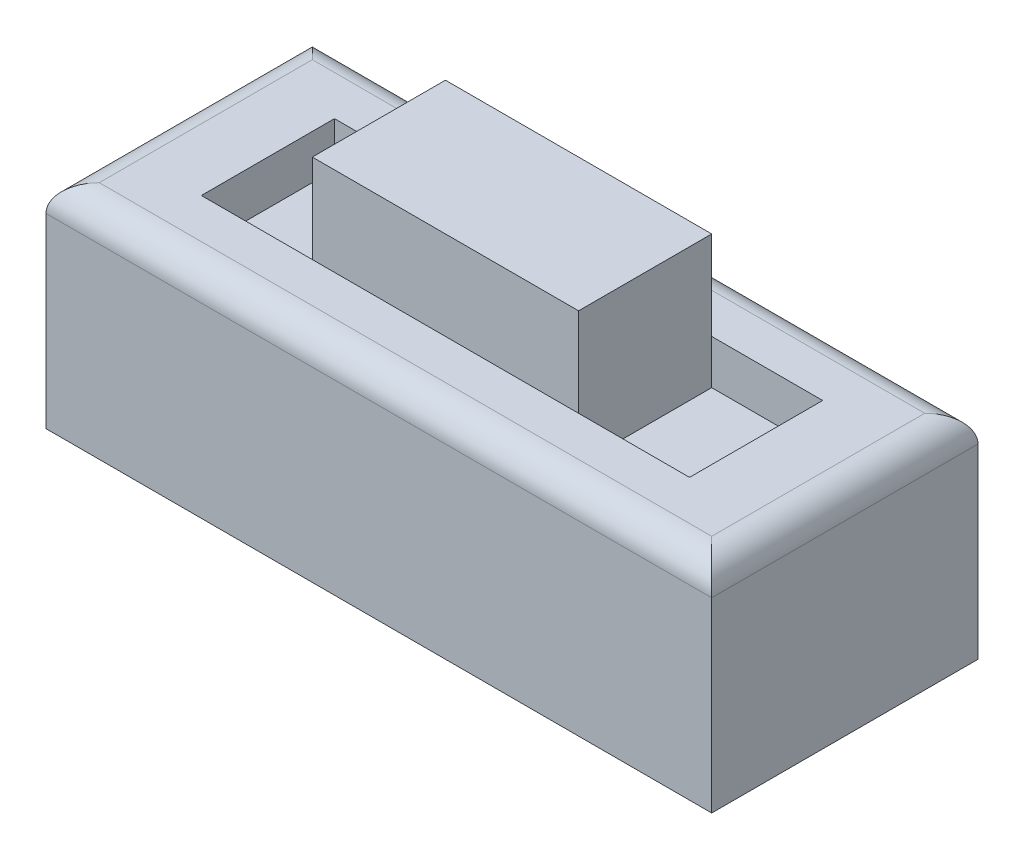
from build123d import *

# Parameters (mm, degrees)
SKETCH1_W           = 7.5
SKETCH1_H           = 3
BOSS_EXTRUDE1_DEPTH = 2.4
SKETCH2_W           = 3
SKETCH2_H           = 1.5
BOSS_EXTRUDE2_DEPTH = 1
SKETCH3_W           = 1.25
SKETCH3_H           = 1.5
CUT_EXTRUDE1_DEPTH  = 0.5
SKETCH4_W           = 0.5
SKETCH4_H           = 1
CUT_EXTRUDE2_DEPTH  = 1
FILLET1_R           = 0.3


with BuildPart() as part:
    # Sketch1 → Boss-Extrude1 (new body)
    with BuildSketch(Plane(origin=(0, 0, 0), x_dir=(1, 0, 0), z_dir=(0, 1, 0))):
        with Locations((-0.439685246, 1.166396104)):
            Rectangle(SKETCH1_W, SKETCH1_H)
    extrude(amount=BOSS_EXTRUDE1_DEPTH)

    # Sketch2 → Boss-Extrude2 (add)
    with BuildSketch(Plane(origin=(0, 2.4, 0), x_dir=(1, 0, 0), z_dir=(0, 1, 0))):
        with Locations((-0.439685246, 1.166396104)):
            Rectangle(SKETCH2_W, SKETCH2_H)
    extrude(amount=BOSS_EXTRUDE2_DEPTH)

    # Sketch3 → Cut-Extrude1 (cut)
    with BuildSketch(Plane(origin=(0, 2.4, 0), x_dir=(1, 0, 0), z_dir=(0, 1, 0))):
        with Locations((1.685314754, 1.166396104)):
            Rectangle(SKETCH3_W, SKETCH3_H)
        with Locations((-2.564685246, 1.166396104)):
            Rectangle(SKETCH3_W, SKETCH3_H)
    extrude(amount=-CUT_EXTRUDE1_DEPTH, mode=Mode.SUBTRACT)

    # Sketch4 → Cut-Extrude2 (cut)
    with BuildSketch(Plane.XZ):
        with Locations((2.060314754, -1.211874682)):
            Rectangle(SKETCH4_W, SKETCH4_H)
        with Locations((-0.439685246, -1.211874682)):
            Rectangle(SKETCH4_W, SKETCH4_H)
        with Locations((-2.939685246, -1.211874682)):
            Rectangle(SKETCH4_W, SKETCH4_H)
    extrude(amount=-CUT_EXTRUDE2_DEPTH, mode=Mode.SUBTRACT)

    # Fillet1
    fillet1_edges = [part.edges().sort_by_distance(p)[0] for p in [
        (3.310314754, 2.4, -1.166396104),
        (-0.439685246, 2.4, -2.666396104),
        (-4.189685246, 2.4, -1.166396104),
        (-0.439685246, 2.4, 0.333603896),
    ]]
    fillet(fillet1_edges, radius=FILLET1_R)


solid = part.part
